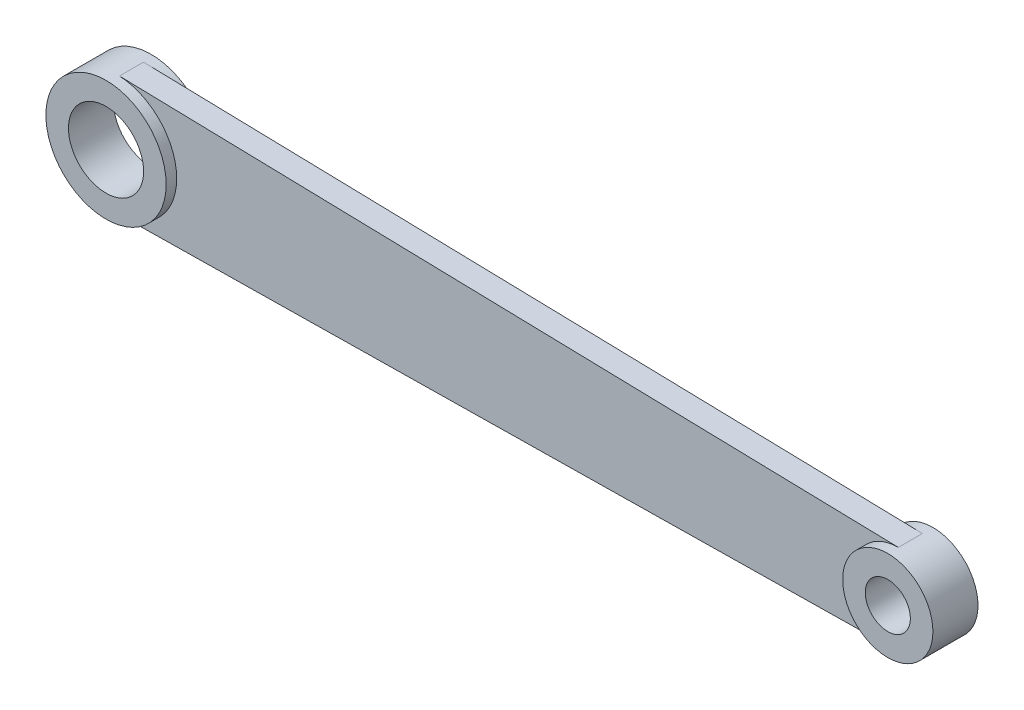
from build123d import *

# Parameters (mm, degrees)
BOSS_EXTRUDE1_DEPTH = 4
SKETCH2_R           = 20
SKETCH2_R_2         = 12.5
SKETCH2_R_3         = 15
SKETCH2_R_4         = 7.5
BOSS_EXTRUDE2_DEPTH = 7.5


with BuildPart() as part:
    # Sketch1 → Boss-Extrude1 (new, symmetric)
    with BuildSketch(Plane.XY):
        with BuildLine():
            Line((59.81488788, 13.727342811), (-199.220649297, 19.976731751))
            ThreePointArc((-199.220649297, 19.976731751), (-185.706002057, 13.796933419), (-180.18511212, 0))
            ThreePointArc((-180.18511212, 0), (-185.84170962, -13.937962718), (-199.611792592, -19.991780929))
            Line((-199.611792592, -19.991780929), (59.81488788, -16.272657189))
            ThreePointArc((59.81488788, -16.272657189), (44.81488788, -1.272657189), (59.81488788, 13.727342811))
        make_face()
    extrude(amount=BOSS_EXTRUDE1_DEPTH, both=True)

    # Sketch2 → Boss-Extrude2 (add, symmetric)
    # profile 1 of 2: a face of its own
    with BuildSketch(Plane.XY):
        with Locations((-200.18511212, 0)):
            Circle(SKETCH2_R)
        with Locations((-200.18511212, 0)):
            Circle(SKETCH2_R_2, mode=Mode.SUBTRACT)
    # profile 2 of 2: a face of its own
    with BuildSketch(Plane.XY):
        with Locations((59.81488788, -1.272657189)):
            Circle(SKETCH2_R_3)
        with Locations((59.81488788, -1.272657189)):
            Circle(SKETCH2_R_4, mode=Mode.SUBTRACT)
    extrude(amount=BOSS_EXTRUDE2_DEPTH, both=True)


solid = part.part
